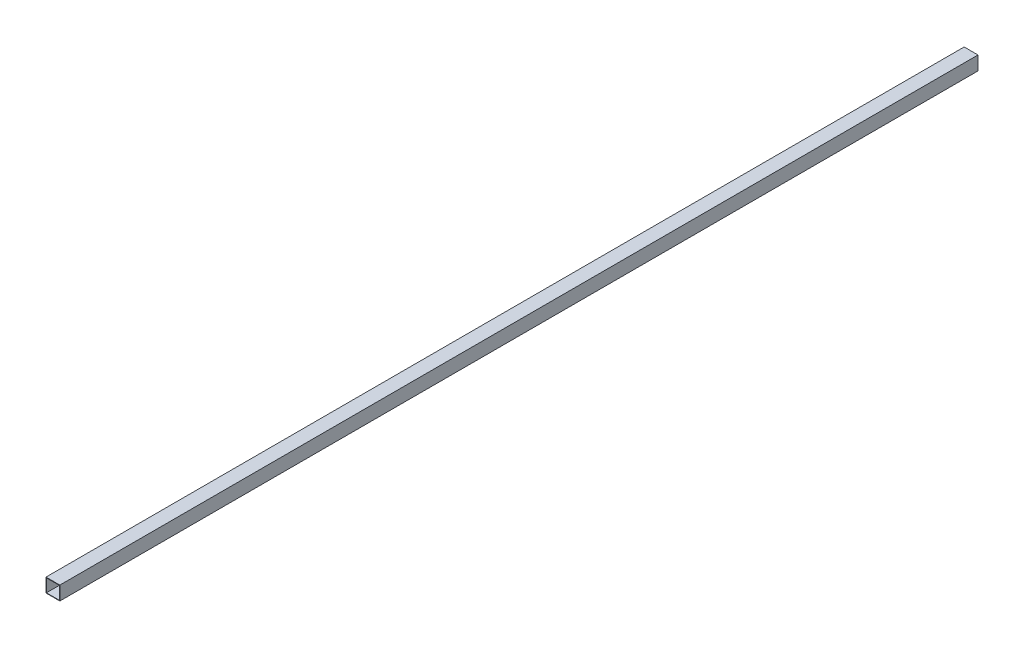
from build123d import *

# Parameters (mm, degrees)
CROQUIS1_W            = 30
CROQUIS1_H            = 30
CROQUIS1_W_2          = 28
CROQUIS1_H_2          = 28
EXTRUIR_L_MINA1_DEPTH = 995


with BuildPart() as part:
    # Croquis1 → Extruir-Lámina1 (new, symmetric)
    with BuildSketch(Plane.XY):
        Rectangle(CROQUIS1_W, CROQUIS1_H)
        Rectangle(CROQUIS1_W_2, CROQUIS1_H_2, mode=Mode.SUBTRACT)
    extrude(amount=EXTRUIR_L_MINA1_DEPTH, both=True)


solid = part.part
